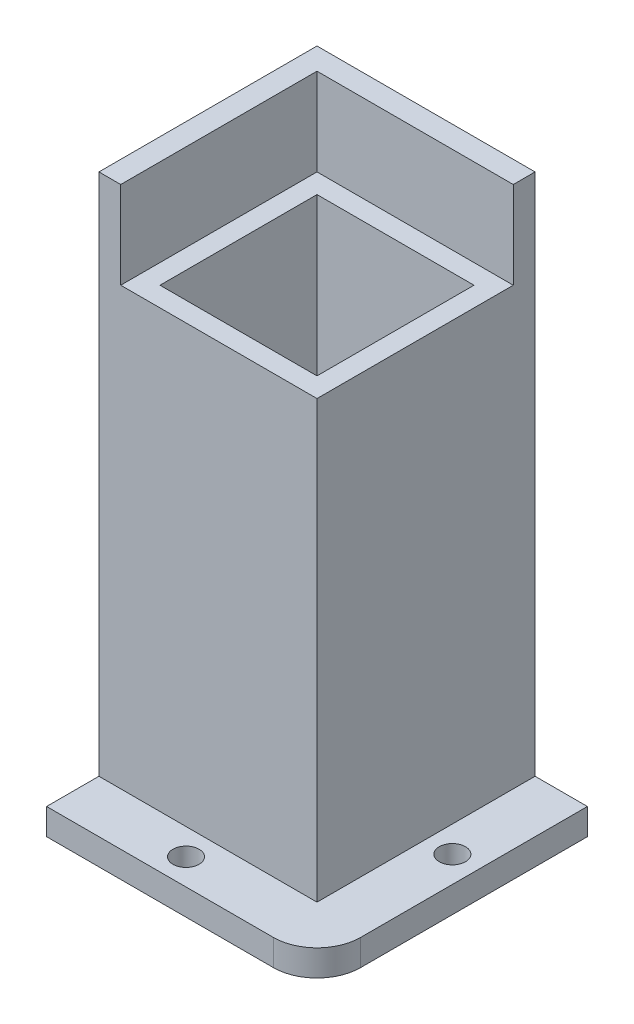
from build123d import *

# Parameters (mm, degrees)
SKETCH1_W           = 25
SKETCH1_H           = 25
BOSS_EXTRUDE1_DEPTH = 63
SKETCH2_W           = 22.5
SKETCH2_H           = 22.5
CUT_EXTRUDE2_DEPTH  = 10
SKETCH4_W           = 25
SKETCH4_H           = 25
SKETCH4_R           = 1.5
BOSS_EXTRUDE2_DEPTH = 3
SKETCH5_W           = 18
SKETCH5_H           = 18
CUT_EXTRUDE3_DEPTH  = 50


with BuildPart() as part:
    # Sketch1 → Boss-Extrude1 (new body)
    with BuildSketch(Plane(origin=(0, 0, 0), x_dir=(1, 0, 0), z_dir=(0, 1, 0))):
        Rectangle(SKETCH1_W, SKETCH1_H)
    extrude(amount=BOSS_EXTRUDE1_DEPTH)

    # Sketch2 → Cut-Extrude2 (cut)
    with BuildSketch(Plane(origin=(0, 63, 0), x_dir=(1, 0, 0), z_dir=(0, 1, 0))):
        with Locations((1.25, -1.25)):
            Rectangle(SKETCH2_W, SKETCH2_H)
    extrude(amount=-CUT_EXTRUDE2_DEPTH, mode=Mode.SUBTRACT)

    # Sketch4 → Boss-Extrude2 (add)
    # profile 1 of 2: a face of its own
    with BuildSketch(Plane.XZ):
        Rectangle(SKETCH4_W, SKETCH4_H)
    # profile 2 of 2: a face of its own
    with BuildSketch(Plane.XZ):
        with BuildLine():
            Line((12.5, 12.5), (12.5, -12.5))
            Line((12.5, -12.5), (18.5, -12.5))
            Line((18.5, -12.5), (18.5, 13.5))
            ThreePointArc((18.5, 13.5), (17.035533906, 17.035533906), (13.5, 18.5))
            Line((13.5, 18.5), (-12.5, 18.5))
            Line((-12.5, 18.5), (-12.5, 12.5))
            Line((-12.5, 12.5), (12.5, 12.5))
        make_face()
        with Locations(Location((15.5, -0.018933946, 0), (0, 0, 270))):
            Circle(SKETCH4_R, mode=Mode.SUBTRACT)
        with Locations(Location((0.48401104, 15.5, 0), (0, 0, 270))):
            Circle(SKETCH4_R, mode=Mode.SUBTRACT)
    extrude(amount=-BOSS_EXTRUDE2_DEPTH)

    # Sketch5 → Cut-Extrude3 (cut)
    with BuildSketch(Plane(origin=(0, 53, 0), x_dir=(1, 0, 0), z_dir=(0, 1, 0))):
        with Locations((1.25, -1.25)):
            Rectangle(SKETCH5_W, SKETCH5_H)
    extrude(amount=-CUT_EXTRUDE3_DEPTH, mode=Mode.SUBTRACT)


solid = part.part
